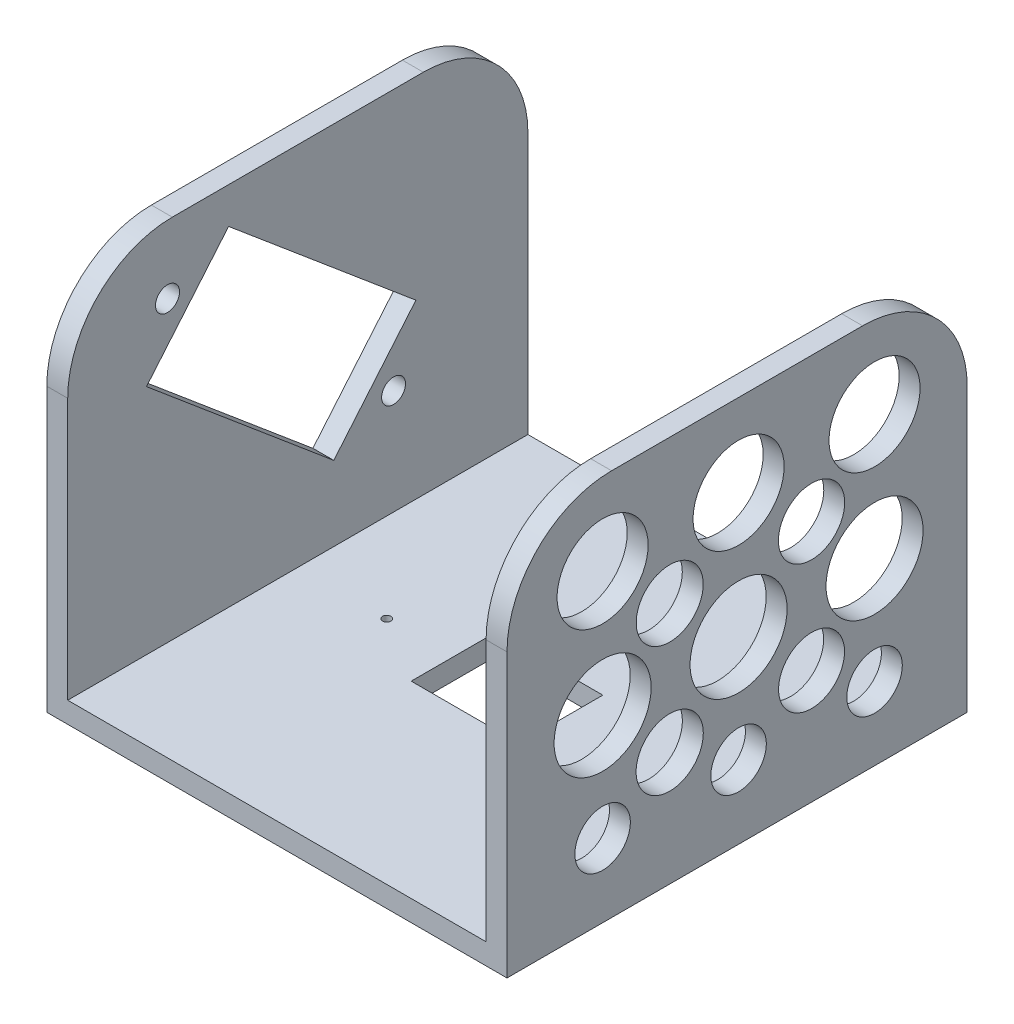
from build123d import *

# Parameters (mm, degrees)
SKETCH2_W           = 44
SKETCH2_H           = 44
BOSS_EXTRUDE1_DEPTH = 2
SKETCH4_W           = 10.31875
SKETCH4_H           = 8
CUT_EXTRUDE1_DEPTH  = 32.176914536
SKETCH5_R           = 0.4
CUT_EXTRUDE2_DEPTH  = 3
SKETCH8_W           = 2
SKETCH8_H           = 44
BOSS_EXTRUDE2_DEPTH = 35
SKETCH11_R          = 1.143
SKETCH11_R_2        = 1.15
CUT_EXTRUDE3_DEPTH  = 10
FILLET1_R           = 10
SKETCH14_R          = 4.351447522
SKETCH14_R_2        = 4.637760651
SKETCH14_R_3        = 2.653670008
CUT_EXTRUDE5_DEPTH  = 10
LPATTERN1_COUNT     = 3
LPATTERN1_PITCH     = 13
SKETCH16_R          = 3.212197925
SKETCH16_R_2        = 3.154230468
SKETCH16_R_3        = 3.167930334
SKETCH16_R_4        = 3.203393346
CUT_EXTRUDE6_DEPTH  = 10


with BuildPart() as part:
    # Sketch2 → Boss-Extrude1 (new body)
    with BuildSketch(Plane(origin=(0, 0, 0), x_dir=(1, 0, 0), z_dir=(0, 1, 0))):
        Rectangle(SKETCH2_W, SKETCH2_H)
    extrude(amount=BOSS_EXTRUDE1_DEPTH)

    # Sketch4 → Cut-Extrude1 (cut, through all)
    with BuildSketch(Plane.XZ):
        Rectangle(SKETCH4_W, SKETCH4_H)
    extrude(amount=-CUT_EXTRUDE1_DEPTH, mode=Mode.SUBTRACT)

    # Sketch5 → Cut-Extrude2 (cut)
    with BuildSketch(Plane.XZ):
        with Locations(Location((-11.5, 0, 0), (0, 0, 270))):
            Circle(SKETCH5_R)
    cut_extrude2 = extrude(amount=-CUT_EXTRUDE2_DEPTH, mode=Mode.SUBTRACT)

    # Mirror1: Cut-Extrude2 across plane
    add(cut_extrude2.mirror(Plane(origin=(0, 0, 0), x_dir=(0, 0, 1), z_dir=(1, 0, 0))), mode=Mode.SUBTRACT)

    # Sketch8 → Boss-Extrude2 (add)
    with BuildSketch(Plane(origin=(0, 2, 0), x_dir=(1, 0, 0), z_dir=(0, 1, 0))):
        with Locations((-21, 0)):
            Rectangle(SKETCH8_W, SKETCH8_H)
    boss_extrude2 = extrude(amount=BOSS_EXTRUDE2_DEPTH)

    # Mirror2: Boss-Extrude2 across plane
    add(boss_extrude2.mirror(Plane(origin=(0, 0, 0), x_dir=(0, 0, 1), z_dir=(1, 0, 0))))

    # Sketch11 → Cut-Extrude3 (cut)
    with BuildSketch(Plane.ZY.offset(22)):
        with Locations((-9.153659498, 12.053864297)):
            Circle(SKETCH11_R)
        with Locations((12.458196086, 30.478767136)):
            Circle(SKETCH11_R_2)
        Polygon((-11.290641548, 18.478237521), (-3.43872233, 9.140820073), (14.47075048, 24.201058573), (6.618831262, 33.538476021), align=None)
    extrude(amount=-CUT_EXTRUDE3_DEPTH, mode=Mode.SUBTRACT)

    # Fillet1
    fillet1_edges = [part.edges().sort_by_distance(p)[0] for p in [
        (-21, 37, 22),
        (-21, 37, -22),
        (21, 37, -22),
        (21, 37, 22),
    ]]
    fillet(fillet1_edges, radius=FILLET1_R)

    # Sketch14 → Cut-Extrude5 (cut)
    with BuildSketch(Plane(origin=(22, 0, 0), x_dir=(0, 0, -1), z_dir=(1, 0, 0))):
        with Locations((-12.858925156, 29.108613253)):
            Circle(SKETCH14_R)
        with Locations((-12.858925156, 17.175691446)):
            Circle(SKETCH14_R_2)
        with Locations((-12.858925156, 6.998624266)):
            Circle(SKETCH14_R_3)
    cut_extrude5 = extrude(amount=-CUT_EXTRUDE5_DEPTH, mode=Mode.SUBTRACT)

    # LPattern1: Cut-Extrude5 ×3
    with Locations(*[(0, 0, -i * LPATTERN1_PITCH) for i in range(1, LPATTERN1_COUNT)]):
        add(cut_extrude5, mode=Mode.SUBTRACT)

    # Sketch16 → Cut-Extrude6 (cut)
    with BuildSketch(Plane(origin=(22, 0, 0), x_dir=(0, 0, -1), z_dir=(1, 0, 0))):
        with Locations((-6.443418132, 10.901979994)):
            Circle(SKETCH16_R)
        with Locations((7.118442889, 10.901979994)):
            Circle(SKETCH16_R_2)
        with Locations((7.118442889, 23.236523275)):
            Circle(SKETCH16_R_3)
        with Locations((-6.443418132, 23.236523275)):
            Circle(SKETCH16_R_4)
    extrude(amount=-CUT_EXTRUDE6_DEPTH, mode=Mode.SUBTRACT)


solid = part.part
